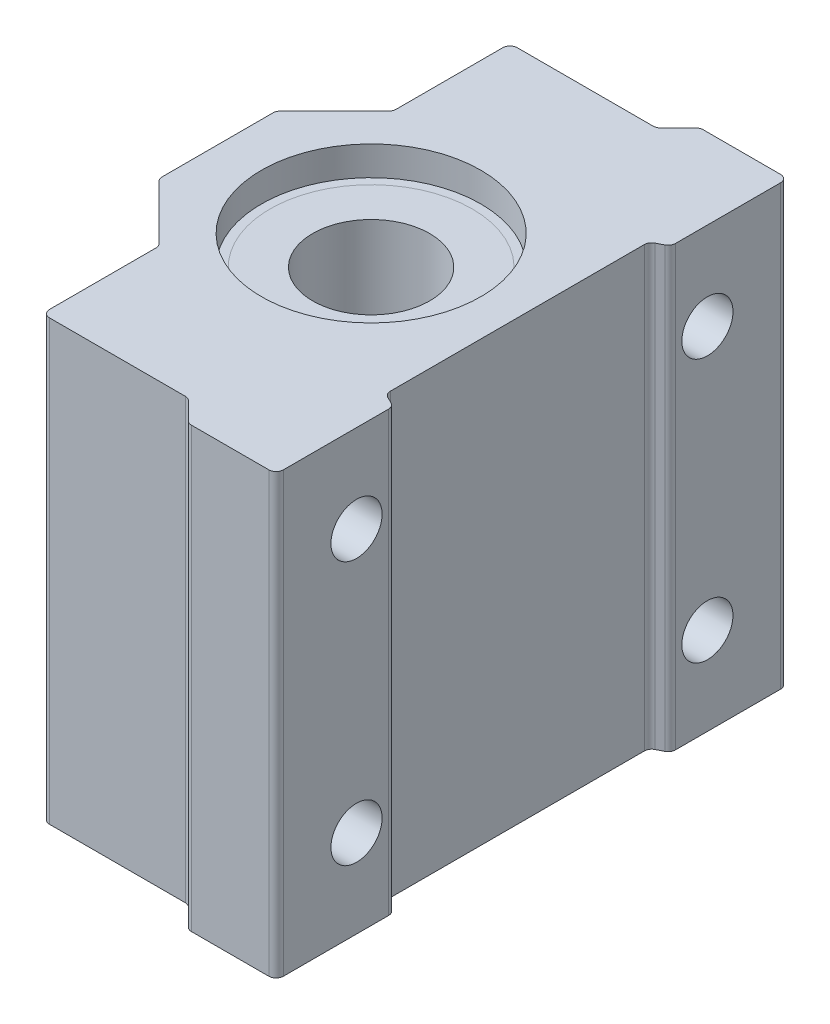
from build123d import *

# Parameters (mm, degrees)
BOSS_EXTRUDE1_DEPTH = 30
FILLET1_R           = 0.5
SKETCH2_R           = 7.5
CUT_EXTRUDE1_DEPTH  = 30
SKETCH4_R           = 7.5
SKETCH4_R_2         = 6.911436733
BOSS_EXTRUDE2_DEPTH = 26
SKETCH5_R           = 6.911436733
SKETCH5_R_2         = 4
BOSS_EXTRUDE3_DEPTH = 26
SKETCH6_R           = 1.75
CUT_EXTRUDE2_DEPTH  = 26


with BuildPart() as part:
    # Sketch1 → Boss-Extrude1 (new body)
    with BuildSketch(Plane(origin=(0, 0, 0), x_dir=(1, 0, 0), z_dir=(0, 1, 0))):
        Polygon((2.543478261, 7.695652174), (2.543478261, -10.304347826), (3.543478261, -10.804347826), (3.543478261, -18.804347826), (-2.456521739, -18.804347826), (-3.956521739, -17.304347826), (-13.956521739, -17.304347826), (-13.956521739, -9.304347826), (-17.956521739, -5.304347826), (-17.956521739, 2.695652174), (-13.956521739, 6.695652174), (-13.956521739, 14.695652174), (-3.956521739, 14.695652174), (-2.456521739, 16.195652174), (3.543478261, 16.195652174), (3.543478261, 8.195652174), align=None)
    extrude(amount=BOSS_EXTRUDE1_DEPTH)

    # Fillet1
    fillet1_edges = [part.edges().sort_by_distance(p)[0] for p in [
        (2.543478261, 15, 10.304347826),
        (3.543478261, 15, 10.804347826),
        (3.543478261, 15, 18.804347826),
        (-2.456521739, 15, 18.804347826),
        (-3.956521739, 15, 17.304347826),
        (-13.956521739, 15, 17.304347826),
        (-13.956521739, 15, 9.304347826),
        (-17.956521739, 15, 5.304347826),
        (-17.956521739, 15, -2.695652174),
        (-13.956521739, 15, -6.695652174),
        (-13.956521739, 15, -14.695652174),
        (-3.956521739, 15, -14.695652174),
        (-2.456521739, 15, -16.195652174),
        (3.543478261, 15, -16.195652174),
        (3.543478261, 15, -8.195652174),
        (2.543478261, 15, -7.695652174),
    ]]
    fillet(fillet1_edges, radius=FILLET1_R)

    # Sketch2 → Cut-Extrude1 (cut)
    with BuildSketch(Plane.XZ):
        with Locations(Location((-7.456521739, 1.304347826, 0), (0, 0, 270))):
            Circle(SKETCH2_R)
    extrude(amount=-CUT_EXTRUDE1_DEPTH, mode=Mode.SUBTRACT)

    # Sketch4 → Boss-Extrude2 (add)
    with BuildSketch(Plane(origin=(0, 2, 0), x_dir=(1, 0, 0), z_dir=(0, 1, 0))):
        with Locations(Location((-7.456521739, -1.304347826, 0), (0, 0, 90))):
            Circle(SKETCH4_R)
        with Locations(Location((-7.456521739, -1.304347826, 0), (0, 0, 90))):
            Circle(SKETCH4_R_2, mode=Mode.SUBTRACT)
    extrude(amount=BOSS_EXTRUDE2_DEPTH)

    # Sketch6 → Cut-Extrude2 (cut)
    with BuildSketch(Plane.ZY.offset(13.956521739)):
        with Locations((13.304347826, 24)):
            Circle(SKETCH6_R)
        with Locations((13.304347826, 6)):
            Circle(SKETCH6_R)
        with Locations((-10.695652174, 6)):
            Circle(SKETCH6_R)
        with Locations((-10.695652174, 24)):
            Circle(SKETCH6_R)
    extrude(amount=-CUT_EXTRUDE2_DEPTH, mode=Mode.SUBTRACT)


with BuildPart() as body_2:
    # Sketch5 → Boss-Extrude3 (new body)
    with BuildSketch(Plane(origin=(0, 2, 0), x_dir=(1, 0, 0), z_dir=(0, 1, 0))):
        with Locations(Location((-7.456521739, -1.304347826, 0), (0, 0, 90))):
            Circle(SKETCH5_R)
        with Locations(Location((-7.456521739, -1.304347826, 0), (0, 0, 90))):
            Circle(SKETCH5_R_2, mode=Mode.SUBTRACT)
    extrude(amount=BOSS_EXTRUDE3_DEPTH)


solid = Compound([part.part, body_2.part])
